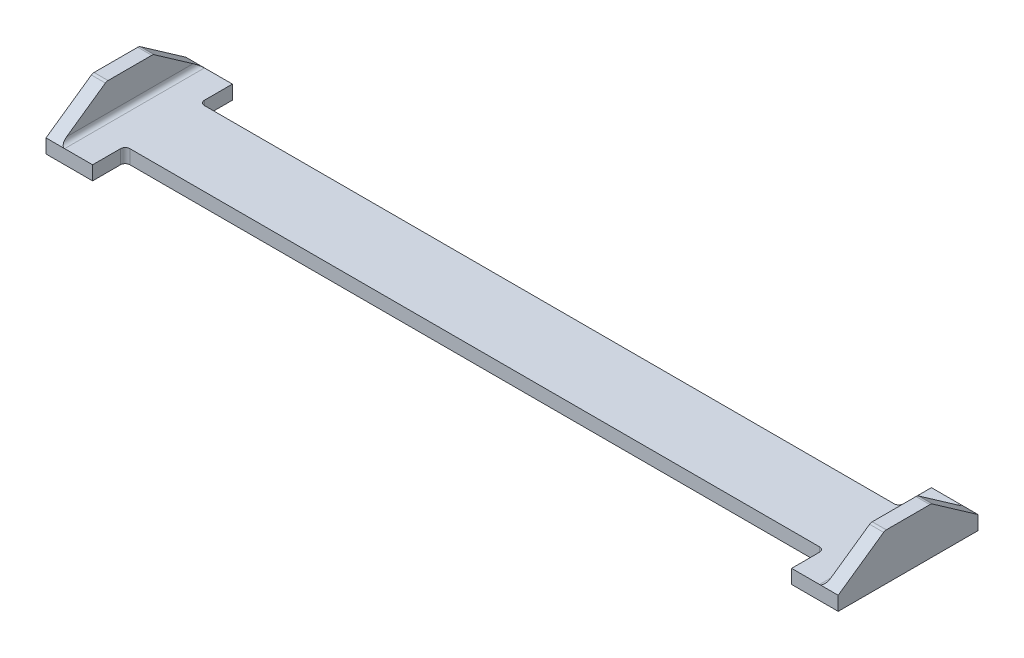
from build123d import *

# Parameters (mm, degrees)
BOSS_EXTRUDE1_DEPTH = 3.81
BOSS_EXTRUDE2_DEPTH = 3.81
FILLET1_R           = 1.27
FILLET2_R           = 1.27


with BuildPart() as part:
    # Sketch1 → Boss-Extrude1 (new body)
    with BuildSketch(Plane(origin=(0, 0, 0), x_dir=(1, 0, 0), z_dir=(0, 1, 0))):
        Polygon((95.25, 10.16), (-95.25, 10.16), (-95.25, 19.05), (-107.95, 19.05), (-107.95, -19.05), (-95.25, -19.05), (-95.25, -10.16), (95.25, -10.16), (95.25, -19.05), (107.95, -19.05), (107.95, 19.05), (95.25, 19.05), align=None)
    extrude(amount=BOSS_EXTRUDE1_DEPTH)

    # Sketch2 → Boss-Extrude2 (add)
    with BuildSketch(Plane.ZY.offset(107.95)):
        Polygon((-19.05, 0), (-19.05, 3.81), (-6.35, 12.7), (6.35, 12.7), (19.05, 3.81), (19.05, 0), align=None)
    boss_extrude2 = extrude(amount=-BOSS_EXTRUDE2_DEPTH)

    # Mirror1: Boss-Extrude2 across plane
    add(boss_extrude2.mirror(Plane(origin=(0, 0, 0), x_dir=(0, 0, 1), z_dir=(1, 0, 0))))

    # Fillet1
    fillet1_edges = [part.edges().sort_by_distance(p)[0] for p in [
        (-104.14, 3.81, 0),
        (-106.045, 12.7, -6.35),
        (-106.045, 12.7, 6.35),
        (104.14, 3.81, 0),
        (106.045, 12.7, 6.35),
        (106.045, 12.7, -6.35),
    ]]
    fillet(fillet1_edges, radius=FILLET1_R)

    # Fillet2
    fillet2_edges = [part.edges().sort_by_distance(p)[0] for p in [
        (-95.25, 1.905, -10.16),
        (95.25, 1.905, -10.16),
        (95.25, 1.905, 10.16),
        (-95.25, 1.905, 10.16),
    ]]
    fillet(fillet2_edges, radius=FILLET2_R)


solid = part.part
